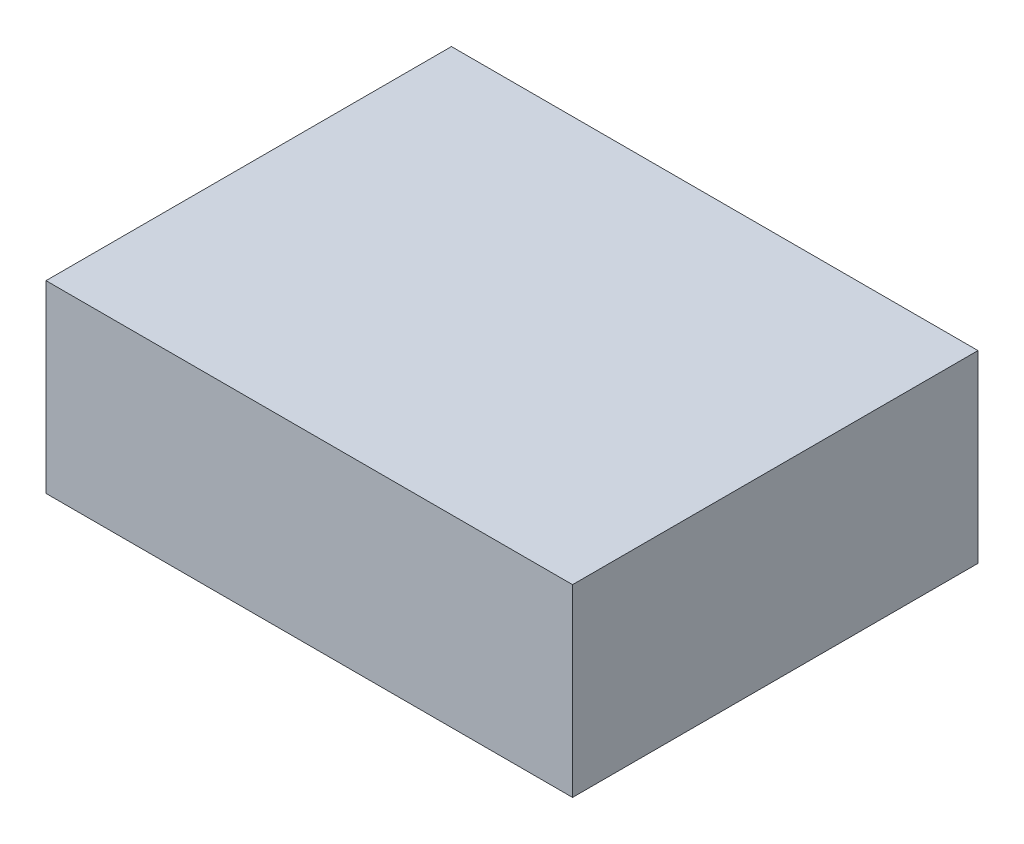
from build123d import *

# Parameters (mm, degrees)
SKETCH1_W           = 50.8
SKETCH1_H           = 39.116
BOSS_EXTRUDE1_DEPTH = 17.78


with BuildPart() as part:
    # Sketch1 → Boss-Extrude1 (new body)
    with BuildSketch(Plane(origin=(0, 0, 0), x_dir=(1, 0, 0), z_dir=(0, 1, 0))):
        with Locations((25.4, 19.558)):
            Rectangle(SKETCH1_W, SKETCH1_H)
    extrude(amount=BOSS_EXTRUDE1_DEPTH)


solid = part.part
